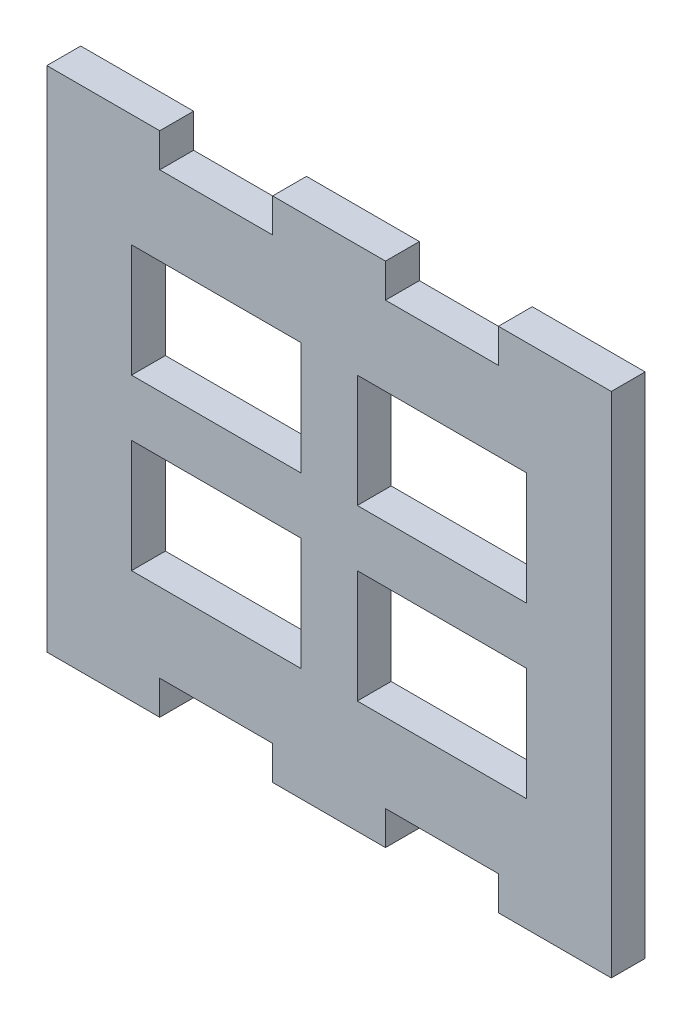
from build123d import *

# Parameters (mm, degrees)
ESQUISSE1_W             = 50
ESQUISSE1_H             = 45
BOSS_EXTRU_1_DEPTH      = 3
ESQUISSE2_W             = 10
ESQUISSE2_H             = 3
ENL_V_MAT_EXTRU_1_DEPTH = 10
ESQUISSE3_W             = 15
ESQUISSE3_H             = 10
ENL_V_MAT_EXTRU_2_DEPTH = 10
ESQUISSE4_W             = 10
ESQUISSE4_H             = 3
ENL_V_MAT_EXTRU_3_DEPTH = 10


with BuildPart() as part:
    # Esquisse1 → Boss.-Extru.1 (new body)
    with BuildSketch(Plane.XY):
        with Locations((25, 22.5)):
            Rectangle(ESQUISSE1_W, ESQUISSE1_H)
    extrude(amount=BOSS_EXTRU_1_DEPTH)

    # Esquisse2 → Enlèv. mat.-Extru.1 (cut)
    with BuildSketch(Plane.XY.offset(3)):
        with Locations((15, 1.5)):
            Rectangle(ESQUISSE2_W, ESQUISSE2_H)
        with Locations((35, 1.5)):
            Rectangle(ESQUISSE2_W, ESQUISSE2_H)
    extrude(amount=-ENL_V_MAT_EXTRU_1_DEPTH, mode=Mode.SUBTRACT)

    # Esquisse3 → Enlèv. mat.-Extru.2 (cut)
    with BuildSketch(Plane.XY.offset(3)):
        with Locations((35, 30)):
            Rectangle(ESQUISSE3_W, ESQUISSE3_H)
        with Locations((15, 30)):
            Rectangle(ESQUISSE3_W, ESQUISSE3_H)
        with Locations((35, 15)):
            Rectangle(ESQUISSE3_W, ESQUISSE3_H)
        with Locations((15, 15)):
            Rectangle(ESQUISSE3_W, ESQUISSE3_H)
    extrude(amount=-ENL_V_MAT_EXTRU_2_DEPTH, mode=Mode.SUBTRACT)

    # Esquisse4 → Enlèv. mat.-Extru.3 (cut)
    with BuildSketch(Plane.XY.offset(3)):
        with Locations((15, 43.5)):
            Rectangle(ESQUISSE4_W, ESQUISSE4_H)
        with Locations((35, 43.5)):
            Rectangle(ESQUISSE4_W, ESQUISSE4_H)
    extrude(amount=-ENL_V_MAT_EXTRU_3_DEPTH, mode=Mode.SUBTRACT)


solid = part.part
